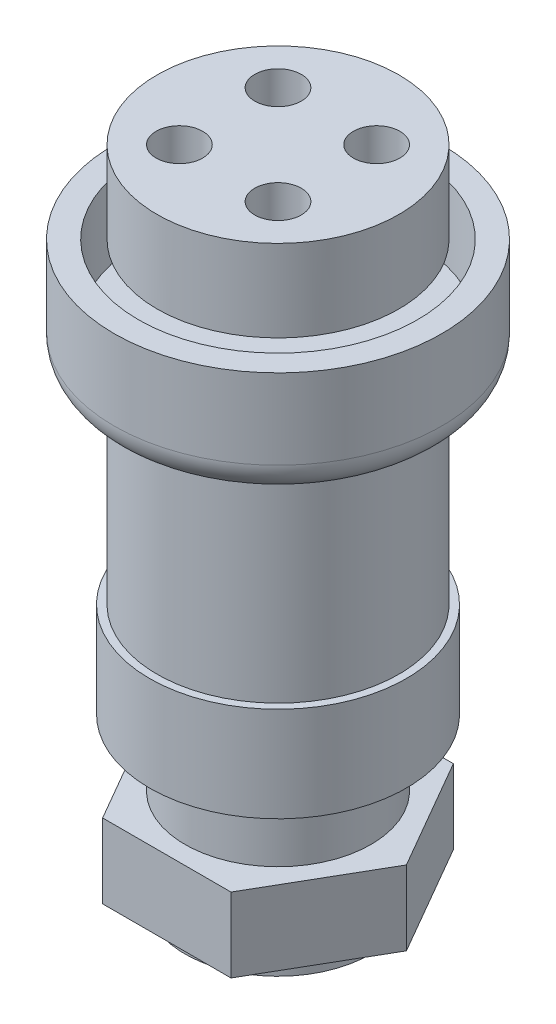
from build123d import *

# Parameters (mm, degrees)
SZKIC19_R                   = 1.25
WYTNIJ_WYCI_GNI_CIE2_DEPTH  = 6
DODANIE_WYCI_GNI_CIE1_DEPTH = 4
SZKIC21_R                   = 8.8
DODANIE_WYCI_GNI_CIE2_DEPTH = 6
ZAOKR_GLENIE1_R             = 1.7
SZKIC22_R                   = 7.5
WYTNIJ_WYCI_GNI_CIE3_DEPTH  = 4


with BuildPart() as part:
    # Szkic18 → Obrót4 (revolve)
    with BuildSketch(Plane.XY, mode=Mode.PRIVATE) as obr_t4_sk:
        Polygon((14.249151908, 9.3), (20.749151908, 9.3), (20.749151908, 0), (21.499151908, 0), (21.499151908, -1.1), (20.749151908, -1.1), (20.749151908, -12.1), (21.149151908, -12.1), (21.149151908, -17.2), (19.249151908, -18.17860252), (19.249151908, -25.873716184), (14.249151908, -25.873716184), align=None)
    revolve(obr_t4_sk.sketch.rotate(Axis((14.249151908, -25.873716184, 0), (0, 1, 0)), 90), axis=Axis((14.249151908, -25.873716184, 0), (0, 1, 0)))

    # Szkic19 → Wytnij-wyciągnięcie2 (cut)
    with BuildSketch(Plane(origin=(0, 9.3, 0), x_dir=(1, 0, 0), z_dir=(0, 1, 0))):
        with Locations(Location((11.599151908, 2.65, 0), (0, 0, 270))):
            Circle(SZKIC19_R)
        with Locations(Location((16.899151908, 2.65, 0), (0, 0, 270))):
            Circle(SZKIC19_R)
        with Locations(Location((16.899151908, -2.65, 0), (0, 0, 270))):
            Circle(SZKIC19_R)
        with Locations(Location((11.599151908, -2.65, 0), (0, 0, 270))):
            Circle(SZKIC19_R)
    extrude(amount=-WYTNIJ_WYCI_GNI_CIE2_DEPTH, mode=Mode.SUBTRACT)

    # Szkic20 → Dodanie-wyciągnięcie1 (add)
    with BuildSketch(Plane(origin=(0, -24.773716184, 0), x_dir=(-1, 0, 0), z_dir=(0, -1, 0))):
        Polygon((-7.349151908, 0), (-10.799151908, 5.975575286), (-17.699151908, 5.975575286), (-21.149151908, 0), (-17.699151908, -5.975575286), (-10.799151908, -5.975575286), align=None)
    extrude(amount=-DODANIE_WYCI_GNI_CIE1_DEPTH)

    # Szkic21 → Dodanie-wyciągnięcie2 (add)
    with BuildSketch(Plane.XZ.offset(1.1)):
        with Locations(Location((14.249151908, 0, 0), (0, 0, 270))):
            Circle(SZKIC21_R)
    extrude(amount=-DODANIE_WYCI_GNI_CIE2_DEPTH)

    # Zaokrąglenie1
    zaokr_glenie1_edges = [part.edges().sort_by_distance(p)[0] for p in [
        (14.249151908, -1.1, 8.8),
    ]]
    fillet(zaokr_glenie1_edges, radius=ZAOKR_GLENIE1_R)

    # Szkic22 → Wytnij-wyciągnięcie3 (cut)
    with BuildSketch(Plane(origin=(0, 4.9, 0), x_dir=(1, 0, 0), z_dir=(0, 1, 0))):
        with Locations(Location((14.249151908, 0, 0), (0, 0, 270))):
            Circle(SZKIC22_R)
    extrude(amount=-WYTNIJ_WYCI_GNI_CIE3_DEPTH, mode=Mode.SUBTRACT)


with BuildPart() as wytnij_wyci_gni_cie3_piece_1:
    # of the separate pieces the step leaves, piece 1, a body of its own (wytnij_wyci_gni_cie3_pieces)
    add(part.part.solids().sort_by_distance((14.249151908, 0.6, -8.8))[0])


with BuildPart() as wytnij_wyci_gni_cie3_piece_2:
    # of the separate pieces the step leaves, piece 2, a body of its own (wytnij_wyci_gni_cie3_pieces)
    add(part.part.solids().sort_by_distance((14.249151908, 9.3, -6.5))[0])


solid = Compound([wytnij_wyci_gni_cie3_piece_1.part, wytnij_wyci_gni_cie3_piece_2.part])
